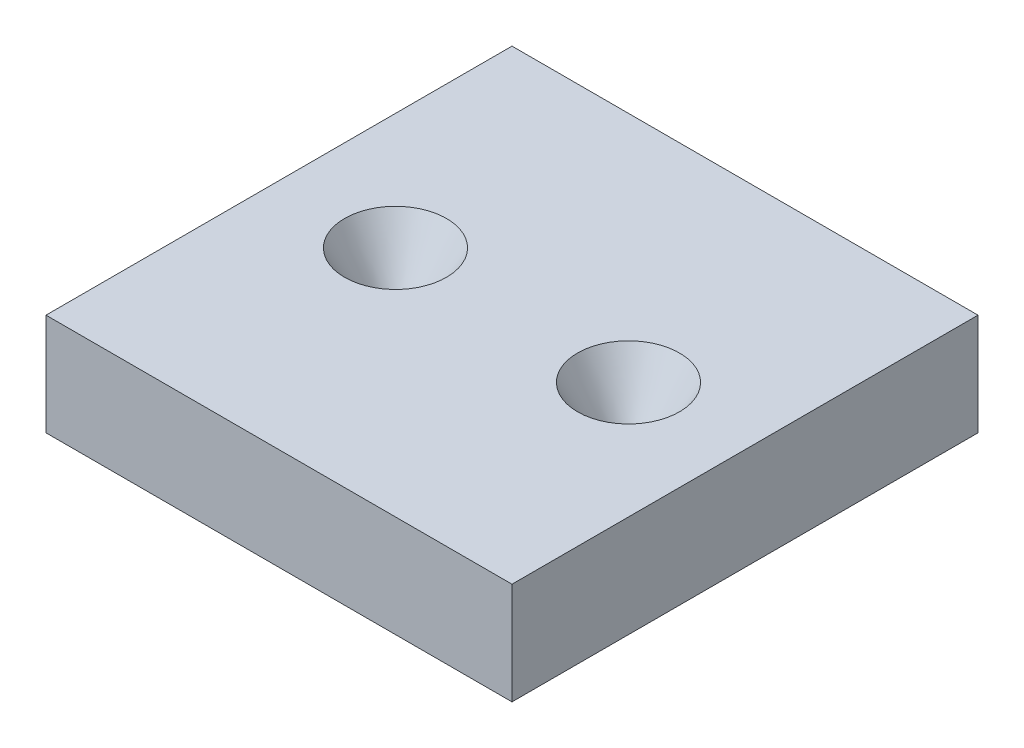
from build123d import *

# Parameters (mm, degrees)
SKETCH1_W                                            = 32
SKETCH1_H                                            = 32
BOSS_EXTRUDE1_DEPTH                                  = 3.5
CSK_FOR_M1_6_COUNTERSUNK_FLAT_HEAD_SCREW_D           = 1.8
CSK_FOR_M1_6_COUNTERSUNK_FLAT_HEAD_SCREW_CSINK_D     = 7
CSK_FOR_M1_6_COUNTERSUNK_FLAT_HEAD_SCREW_CSINK_ANGLE = 60


with BuildPart() as part:
    # Sketch1 → Boss-Extrude1 (new, symmetric)
    with BuildSketch(Plane(origin=(0, 0, 0), x_dir=(1, 0, 0), z_dir=(0, 1, 0))):
        Rectangle(SKETCH1_W, SKETCH1_H)
    extrude(amount=BOSS_EXTRUDE1_DEPTH, both=True)

    # CSK for M1.6 Countersunk Flat Head Screw1 (through all)
    with Locations(Plane(origin=(8, 3.5, 0), x_dir=(0, 0, 1), z_dir=(0, 1, 0))):
        with Locations((0, 0), (0, -16)):
            CounterSinkHole(CSK_FOR_M1_6_COUNTERSUNK_FLAT_HEAD_SCREW_D / 2, CSK_FOR_M1_6_COUNTERSUNK_FLAT_HEAD_SCREW_CSINK_D / 2, counter_sink_angle=CSK_FOR_M1_6_COUNTERSUNK_FLAT_HEAD_SCREW_CSINK_ANGLE)


solid = part.part
